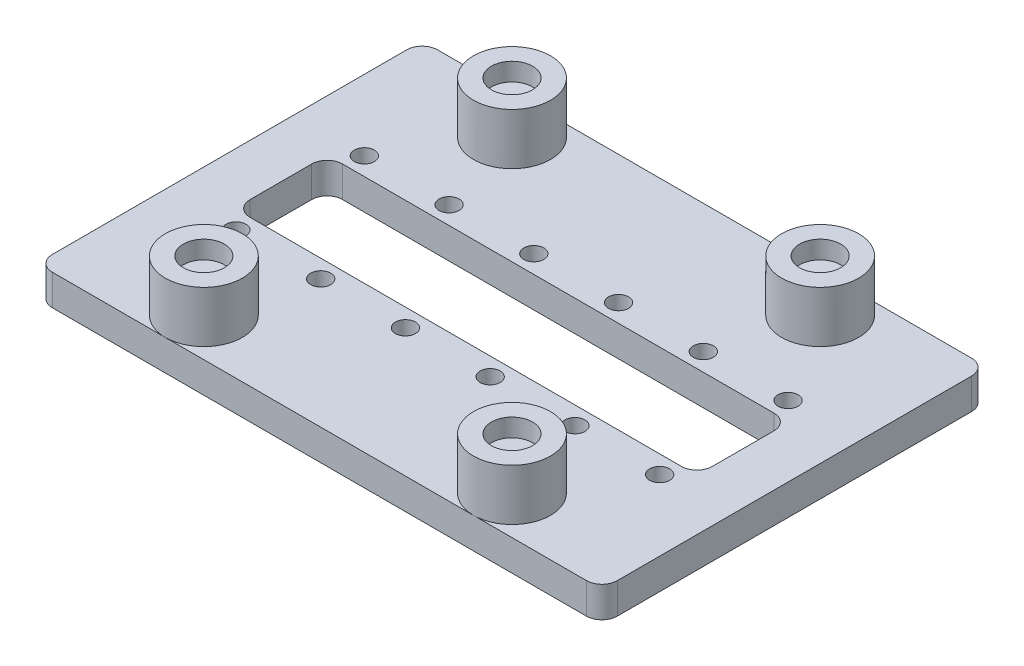
from build123d import *

# Parameters (mm, degrees)
SKETCH1_W                            = 110
SKETCH1_H                            = 75
BOSS_EXTRUDE1_DEPTH                  = 6
SKETCH2_W                            = 90
SKETCH2_H                            = 18
CUT_EXTRUDE1_DEPTH                   = 10
FILLET1_R                            = 3
F_3_9_3_9_DIAMETER_HOLE1_D           = 3.9
F_3_9_3_9_DIAMETER_HOLE1_DEPTH       = 15
F_3_9_3_9_DIAMETER_HOLE1_CSINK_D     = 3.95
F_3_9_3_9_DIAMETER_HOLE1_CSINK_ANGLE = 90
F_3_9_3_9_DIAMETER_HOLE1_TIP         = 1.171678207
FILLET2_R                            = 3
SKETCH6_R                            = 7.5
BOSS_EXTRUDE3_DEPTH                  = 10
SKETCH7_R                            = 4
CUT_EXTRUDE2_DEPTH                   = 3.5


with BuildPart() as part:
    # Sketch1 → Boss-Extrude1 (new body)
    with BuildSketch(Plane(origin=(0, 0, 0), x_dir=(1, 0, 0), z_dir=(0, 1, 0))):
        Rectangle(SKETCH1_W, SKETCH1_H)
    extrude(amount=BOSS_EXTRUDE1_DEPTH)

    # Sketch2 → Cut-Extrude1 (cut)
    with BuildSketch(Plane(origin=(0, 6, 0), x_dir=(1, 0, 0), z_dir=(0, 1, 0))):
        Rectangle(SKETCH2_W, SKETCH2_H)
    extrude(amount=-CUT_EXTRUDE1_DEPTH, mode=Mode.SUBTRACT)

    # Fillet1
    fillet1_edges = [part.edges().sort_by_distance(p)[0] for p in [
        (45, 3, -9),
        (45, 3, 9),
        (-45, 3, 9),
        (-45, 3, -9),
    ]]
    fillet(fillet1_edges, radius=FILLET1_R)

    # Ø3.9 (3.9) Diameter Hole1
    with Locations(Plane(origin=(0, 0, 0), x_dir=(-1, 0, 0), z_dir=(0, -1, 0))):
        with Locations((0, 0), (8.25, -12.5), (-8.25, 12.5), (-8.25, -12.5), (8.25, 12.5), (24.75, -12.5), (41.25, -12.5), (24.75, 12.5), (41.25, 12.5), (-24.75, 12.5), (-41.25, 12.5), (-24.75, -12.5), (-41.25, -12.5)):
            CounterSinkHole(F_3_9_3_9_DIAMETER_HOLE1_D / 2, F_3_9_3_9_DIAMETER_HOLE1_CSINK_D / 2, depth=F_3_9_3_9_DIAMETER_HOLE1_DEPTH, counter_sink_angle=F_3_9_3_9_DIAMETER_HOLE1_CSINK_ANGLE)
            with Locations((0, 0, -(F_3_9_3_9_DIAMETER_HOLE1_DEPTH + F_3_9_3_9_DIAMETER_HOLE1_TIP / 2))):  # 118° drill point
                Cone(0, F_3_9_3_9_DIAMETER_HOLE1_D / 2, F_3_9_3_9_DIAMETER_HOLE1_TIP, mode=Mode.SUBTRACT)

    # Fillet2
    fillet2_edges = [part.edges().sort_by_distance(p)[0] for p in [
        (55, 3, 37.5),
        (-55, 3, 37.5),
        (-55, 3, -37.5),
        (55, 3, -37.5),
    ]]
    fillet(fillet2_edges, radius=FILLET2_R)

    # Sketch6 → Boss-Extrude3 (add)
    with BuildSketch(Plane(origin=(0, 6, 0), x_dir=(1, 0, 0), z_dir=(0, 1, 0))):
        with Locations(Location((-30, -30, 0), (0, 0, 270))):
            Circle(SKETCH6_R)
        with Locations(Location((30, -30, 0), (0, 0, 270))):
            Circle(SKETCH6_R)
        with Locations(Location((30, 30, 0), (0, 0, 90))):
            Circle(SKETCH6_R)
        with Locations(Location((-30, 30, 0), (0, 0, 90))):
            Circle(SKETCH6_R)
    extrude(amount=BOSS_EXTRUDE3_DEPTH)

    # Sketch7 → Cut-Extrude2 (cut)
    with BuildSketch(Plane(origin=(0, 16, 0), x_dir=(1, 0, 0), z_dir=(0, 1, 0))):
        with Locations(Location((-30, 30, 0), (0, 0, 270))):
            Circle(SKETCH7_R)
        with Locations(Location((30, 30, 0), (0, 0, 270))):
            Circle(SKETCH7_R)
        with Locations(Location((30, -30, 0), (0, 0, 270))):
            Circle(SKETCH7_R)
        with Locations(Location((-30, -30, 0), (0, 0, 270))):
            Circle(SKETCH7_R)
    extrude(amount=-CUT_EXTRUDE2_DEPTH, mode=Mode.SUBTRACT)


solid = part.part
